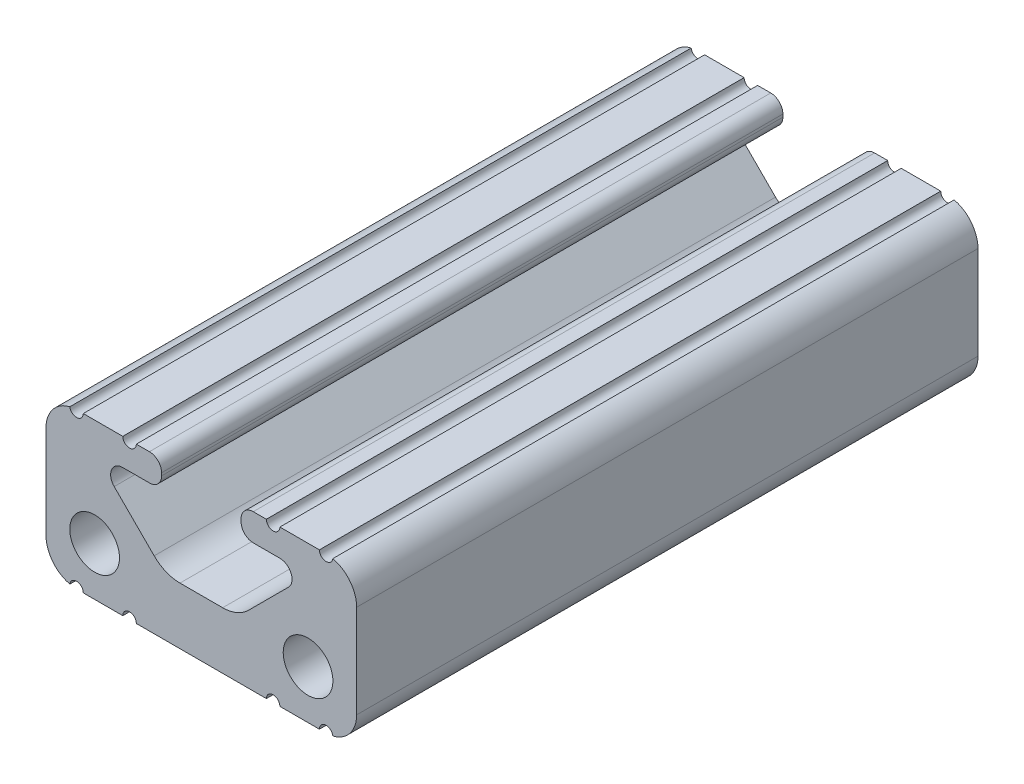
from build123d import *

# Parameters (mm, degrees)
SKETCH3_R               = 2.032
BOSS_EXTRUDE1_DEPTH     = 152.4
CUT_EXTRUDE1_DEPTH      = 154.060029074
CUT_EXTRUDE1_DEPTH_BACK = 154.060029074
SKETCH4_R               = 0.55245
CUT_EXTRUDE2_DEPTH      = 254


with BuildPart() as part:
    # Sketch3 → Boss-Extrude1 (new, symmetric)
    with BuildSketch(Plane.XY):
        with BuildLine():
            Line((3.2512, 5.35559), (3.2512, 5.13461))
            ThreePointArc((3.2512, 5.13461), (3.542455946, 4.431455946), (4.24561, 4.1402))
            Line((4.24561, 4.1402), (6.42239, 4.1402))
            ThreePointArc((6.42239, 4.1402), (7.341105046, 3.526334232), (7.125544054, 2.442635946))
            Line((7.125544054, 2.442635946), (3.854875946, -0.828032163))
            ThreePointArc((3.854875946, -0.828032163), (2.887046479, -1.474715138), (1.745413783, -1.7018))
            Line((1.745413783, -1.7018), (0, -1.7018))
            Line((0, -1.7018), (0, -6.35))
            Line((0, -6.35), (10.16, -6.35))
            ThreePointArc((10.16, -6.35), (11.956051224, -5.606051224), (12.7, -3.81))
            Line((12.7, -3.81), (12.7, 3.81))
            ThreePointArc((12.7, 3.81), (11.956051224, 5.606051224), (10.16, 6.35))
            Line((10.16, 6.35), (4.24561, 6.35))
            ThreePointArc((4.24561, 6.35), (3.542455946, 6.058744054), (3.2512, 5.35559))
        make_face()
        with Locations(Location((8.7249, -2.3876, 0), (0, 0, 180))):
            Circle(SKETCH3_R, mode=Mode.SUBTRACT)
    extrude(amount=BOSS_EXTRUDE1_DEPTH, both=True)

    # Sketch4 → Cut-Extrude1 (cut, two sides: drawn at the far end of the back side and taken through both)
    with BuildSketch(Plane.XY.offset(-CUT_EXTRUDE1_DEPTH_BACK)):
        with Locations((5.86994, 6.35)):
            Circle(SKETCH4_R)
        with Locations((10.20445, 6.35)):
            Circle(SKETCH4_R)
        with Locations((5.86994, -6.35)):
            Circle(SKETCH4_R)
        with Locations((10.20445, -6.35)):
            Circle(SKETCH4_R)
    extrude(amount=CUT_EXTRUDE1_DEPTH + CUT_EXTRUDE1_DEPTH_BACK, mode=Mode.SUBTRACT)

    # Mirror1: part across plane


with BuildPart() as part_1:
    add(part.part)
    add(part.part.mirror(Plane(origin=(0, 0, 0), x_dir=(0, 0, 1), z_dir=(1, 0, 0))))

    # Sketch5 → Cut-Extrude2 (cut)
    with BuildSketch(Plane.XY.offset(152.4)):
        with BuildLine():
            Line((9.652, 6.35), (6.42239, 6.35))
            ThreePointArc((6.42239, 6.35), (5.86994, 5.79755), (5.31749, 6.35))
            Line((5.31749, 6.35), (4.24561, 6.35))
            ThreePointArc((4.24561, 6.35), (3.542455946, 6.058744054), (3.2512, 5.35559))
            Line((3.2512, 5.35559), (3.2512, 5.13461))
            ThreePointArc((3.2512, 5.13461), (3.542455946, 4.431455946), (4.24561, 4.1402))
            Line((4.24561, 4.1402), (6.42239, 4.1402))
            ThreePointArc((6.42239, 4.1402), (7.341105046, 3.526334232), (7.125544054, 2.442635946))
            Line((7.125544054, 2.442635946), (3.854875946, -0.828032163))
            ThreePointArc((3.854875946, -0.828032163), (2.887046479, -1.474715138), (1.745413783, -1.7018))
            Line((1.745413783, -1.7018), (-1.745413783, -1.7018))
            ThreePointArc((-1.745413783, -1.7018), (-2.887046479, -1.474715138), (-3.854875946, -0.828032163))
            Line((-3.854875946, -0.828032163), (-7.125544054, 2.442635946))
            ThreePointArc((-7.125544054, 2.442635946), (-7.341105046, 3.526334232), (-6.42239, 4.1402))
            Line((-6.42239, 4.1402), (-4.24561, 4.1402))
            ThreePointArc((-4.24561, 4.1402), (-3.542455946, 4.431455946), (-3.2512, 5.13461))
            Line((-3.2512, 5.13461), (-3.2512, 5.35559))
            ThreePointArc((-3.2512, 5.35559), (-3.542455946, 6.058744054), (-4.24561, 6.35))
            Line((-4.24561, 6.35), (-5.31749, 6.35))
            ThreePointArc((-5.31749, 6.35), (-5.86994, 5.79755), (-6.42239, 6.35))
            Line((-6.42239, 6.35), (-9.652, 6.35))
            ThreePointArc((-9.652, 6.35), (-10.169350236, 5.798666155), (-10.752439892, 6.279942302))
            ThreePointArc((-10.752439892, 6.279942302), (-12.154542219, 5.382705102), (-12.7, 3.81))
            Line((-12.7, 3.81), (-12.7, -3.81))
            ThreePointArc((-12.7, -3.81), (-12.154542219, -5.382705102), (-10.752439892, -6.279942302))
            ThreePointArc((-10.752439892, -6.279942302), (-10.169350236, -5.798666155), (-9.652, -6.35))
            Line((-9.652, -6.35), (-6.42239, -6.35))
            ThreePointArc((-6.42239, -6.35), (-5.86994, -5.79755), (-5.31749, -6.35))
            Line((-5.31749, -6.35), (5.31749, -6.35))
            ThreePointArc((5.31749, -6.35), (5.86994, -5.79755), (6.42239, -6.35))
            Line((6.42239, -6.35), (9.652, -6.35))
            ThreePointArc((9.652, -6.35), (10.169350236, -5.798666155), (10.752439892, -6.279942302))
            ThreePointArc((10.752439892, -6.279942302), (12.154542219, -5.382705102), (12.7, -3.81))
            Line((12.7, -3.81), (12.7, 3.81))
            ThreePointArc((12.7, 3.81), (12.154542219, 5.382705102), (10.752439892, 6.279942302))
            ThreePointArc((10.752439892, 6.279942302), (10.169350236, 5.798666155), (9.652, 6.35))
        make_face()
    extrude(amount=-CUT_EXTRUDE2_DEPTH, mode=Mode.SUBTRACT)


solid = part_1.part
